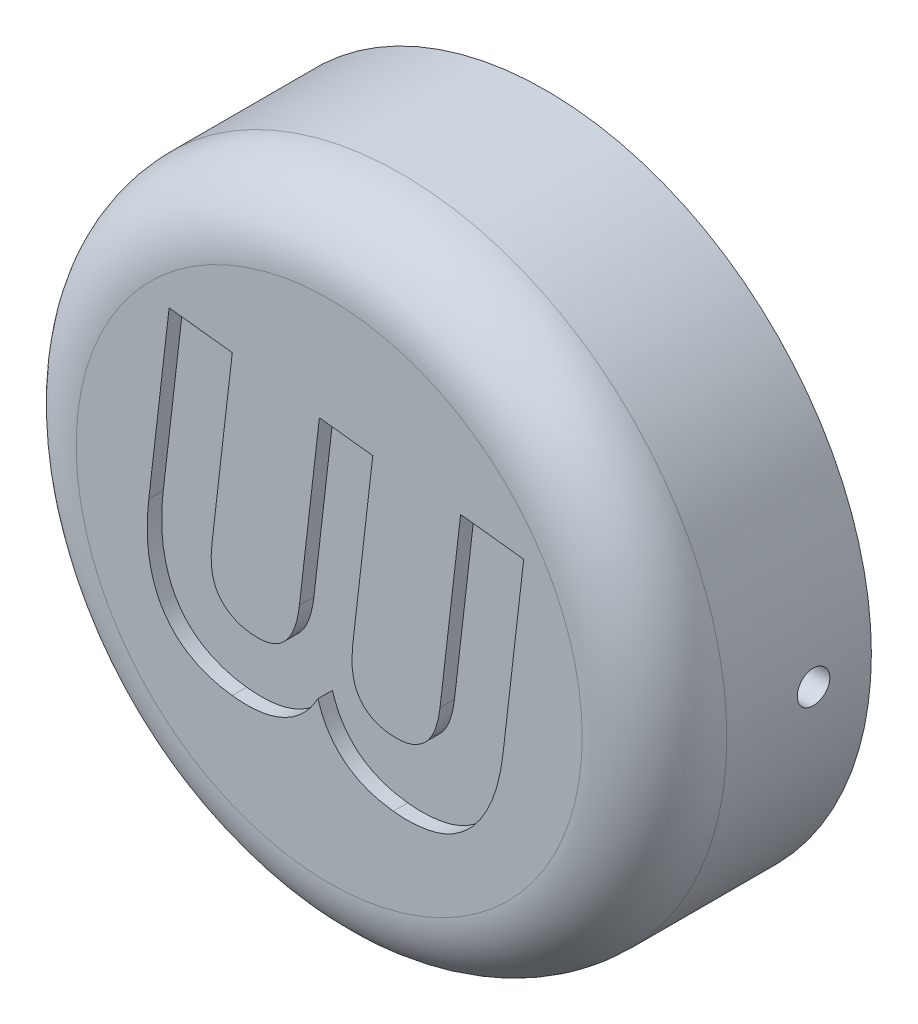
from build123d import *

# Parameters (mm, degrees)
ESQUISSE1_R                  = 45
BOSS_EXTRU_1_DEPTH           = 30
CONG_1_R                     = 10
ESQUISSE3_R                  = 40
ESQUISSE3_R_2                = 7
ESQUISSE3_R_3                = 3.15
ENL_V_MAT_EXTRU_1_DEPTH      = 15
CONG_2_R                     = 10
ENL_V_MAT_EXTRU_2_DEPTH      = 2
BOSS_EXTRU_3_DEPTH           = 22
ENL_V_MAT_EXTRU_3_DEPTH      = 8
ESQUISSE14_W                 = 8
ESQUISSE14_H                 = 7.5
ENL_V_MAT_EXTRU_4_DEPTH      = 8
ESQUISSE15_W                 = 1.5
ESQUISSE15_H                 = 14
ESQUISSE15_W_2               = 2.5
BOSS_EXTRU_4_DEPTH           = 15
ENL_V_MAT_EXTRU_5_DEPTH      = 31
ENL_V_MAT_EXTRU_5_DEPTH_BACK = 15
ESQUISSE16_R                 = 2.25
CONG_3_R                     = 5
ESQUISSE17_R                 = 7
ENL_V_MAT_EXTRU_6_DEPTH      = 8


with BuildPart() as part:
    # Esquisse1 → Boss.-Extru.1 (new body)
    with BuildSketch(Plane.XY):
        Circle(ESQUISSE1_R)
    extrude(amount=BOSS_EXTRU_1_DEPTH)

    # Congé1
    cong_1_edges = [part.edges().sort_by_distance(p)[0] for p in [
        (-45, 0, 30),
    ]]
    fillet(cong_1_edges, radius=CONG_1_R)

    # Esquisse3 → Enlèv. mat.-Extru.1 (cut)
    # profile 1 of 2: a face of its own
    with BuildSketch(Plane(origin=(0, 0, 0), x_dir=(-1, 0, 0), z_dir=(0, 0, -1))):
        Circle(ESQUISSE3_R)
        Circle(ESQUISSE3_R_2, mode=Mode.SUBTRACT)
    # profile 2 of 2: a face of its own
    with BuildSketch(Plane(origin=(0, 0, 0), x_dir=(-1, 0, 0), z_dir=(0, 0, -1))):
        Circle(ESQUISSE3_R_3)
    extrude(amount=-ENL_V_MAT_EXTRU_1_DEPTH, mode=Mode.SUBTRACT)

    # Congé2
    cong_2_edges = [part.edges().sort_by_distance(p)[0] for p in [
        (40, 0, 15),
    ]]
    fillet(cong_2_edges, radius=CONG_2_R)

    # Esquisse4 → Enlèv. mat.-Extru.2 (cut)
    with BuildSketch(Plane.XY.offset(30)):
        with BuildLine():
            Line((-22.144645679, 22.871728166), (-13.411684949, 21.864078851))
            Line((-13.411684949, 21.864078851), (-16.224705953, -2.434964528))
            add(Edge.make_bspline(
                [(-16.224705953, -2.434964528), (-16.256895394, -2.749529996), (-16.318662647, -3.353139284), (-16.340974486, -4.233864403), (-16.297568174, -5.05080651), (-16.209258973, -5.810700887), (-16.049709468, -6.510266382), (-15.835926627, -7.151237119), (-15.544352246, -7.724871201), (-15.102471016, -8.410829584), (-14.391447141, -9.137358845), (-13.364077291, -9.804334199), (-12.168771745, -10.281809796), (-11.302704519, -10.415743134), (-10.850576273, -10.485662702)],
                knots=[0, 0, 0, 0, 1.029052784, 1.9746154, 2.864125884, 3.690516433, 4.461360084, 5.196106019, 5.883704519, 6.550229516, 7.847027763, 9.154782256, 10.514661136, 12, 12, 12, 12], degree=3))
            add(Edge.make_bspline(
                [(-10.850576273, -10.485662702), (-10.388538715, -10.518722359), (-9.507769114, -10.581743082), (-8.241462414, -10.373028261), (-7.130743608, -9.898839405), (-6.180259361, -9.165116879), (-5.41633373, -8.159424838), (-4.807311446, -6.915829185), (-4.36244309, -5.421735756), (-4.205585893, -4.334155707), (-4.122417825, -3.757504254)],
                knots=[0, 0, 0, 0, 1.021408317, 1.94708283, 2.80626198, 3.666415336, 4.56998295, 5.573071206, 6.71320551, 8, 8, 8, 8], degree=3))
            Line((-4.122417825, -3.757504254), (-1.361878556, 20.100692549))
            Line((-1.361878556, 20.100692549), (6.027549754, 19.239992093))
            Line((6.027549754, 19.239992093), (3.246017791, -4.838627999))
            add(Edge.make_bspline(
                [(3.246017791, -4.838627999), (3.195337805, -5.418932779), (3.100060271, -6.509896153), (3.200846418, -8.063631191), (3.502191789, -9.416150043), (4.030577709, -10.569421741), (4.79817358, -11.502650362), (5.789145136, -12.206937692), (6.981097787, -12.714787486), (7.862811963, -12.849833616), (8.326249754, -12.920815213)],
                knots=[0, 0, 0, 0, 1.281245697, 2.408720684, 3.414105471, 4.317064152, 5.176266696, 6.042350125, 6.971039643, 8, 8, 8, 8], degree=3))
            add(Edge.make_bspline(
                [(8.326249754, -12.920815213), (8.788141435, -12.95187261), (9.670978885, -13.011234217), (10.951767235, -12.825942037), (12.09662951, -12.373936159), (12.926595681, -11.793896672), (13.517779888, -11.226565316), (13.904051152, -10.714814626), (14.251276342, -10.139874431), (14.570575393, -9.505698745), (14.812975228, -8.791702106), (15.036199887, -8.026114103), (15.218288171, -7.192139962), (15.290111141, -6.609767539), (15.327313225, -6.308116583)],
                knots=[0, 0, 0, 0, 1.514963289, 2.895627662, 4.203605979, 5.514649424, 6.187972473, 6.883219808, 7.609208956, 8.389033415, 9.205462736, 10.07686117, 11.003873391, 12, 12, 12, 12], degree=3))
            Line((15.327313225, -6.308116583), (18.17182327, 18.274328166))
            Line((18.17182327, 18.274328166), (26.904784001, 17.266678851))
            Line((26.904784001, 17.266678851), (24.060273955, -7.315765898))
            add(Edge.make_bspline(
                [(24.060273955, -7.315765898), (23.967955783, -8.006475678), (23.789795838, -9.339439852), (23.384357503, -11.243708182), (22.85722021, -12.976937412), (22.232797618, -14.545925787), (21.501446812, -15.949427752), (20.701837208, -17.210493748), (19.823941524, -18.330780706), (18.850170073, -19.291918516), (17.80713126, -20.105941628), (16.692463853, -20.773870797), (15.510213899, -21.304477515), (14.25612176, -21.680062816), (12.955241569, -21.910077191), (11.619045856, -22.055429721), (10.247905107, -22.064471081), (9.32643267, -21.979861564), (8.861563453, -21.937177314)],
                knots=[0, 0, 0, 0, 1.394876439, 2.691898066, 3.892940253, 5.018147218, 6.067743577, 7.056852335, 8.004277114, 8.910753966, 9.789328284, 10.647102319, 11.506305359, 12.377222316, 13.26067029, 14.147997917, 15.065692338, 16, 16, 16, 16], degree=3))
            add(Edge.make_bspline(
                [(8.861563453, -21.937177314), (8.193397296, -21.838611708), (6.905963094, -21.64869378), (5.09075363, -21.099474321), (3.476356998, -20.341045448), (2.056804317, -19.378476271), (0.854405876, -18.205860501), (-0.171754699, -16.868311251), (-0.984609243, -15.338236734), (-1.366188524, -14.231821472), (-1.56130915, -13.666055852)],
                knots=[0, 0, 0, 0, 1.141163769, 2.198814248, 3.194086385, 4.147709345, 5.085148259, 6.022512461, 6.988811434, 8, 8, 8, 8], degree=3))
            add(Edge.make_bspline(
                [(-1.56130915, -13.666055852), (-1.871640737, -14.180350205), (-2.475746289, -15.181498932), (-3.614218819, -16.476909983), (-4.899960101, -17.530118409), (-6.330522074, -18.355291156), (-7.908683346, -18.929201697), (-9.627036508, -19.274410878), (-11.485566119, -19.393346682), (-12.761481825, -19.278232362), (-13.422181296, -19.218623432)],
                knots=[0, 0, 0, 0, 1.028409916, 2.001949416, 2.939882333, 3.867066551, 4.819923276, 5.805897814, 6.863841753, 8, 8, 8, 8], degree=3))
            add(Edge.make_bspline(
                [(-13.422181296, -19.218623432), (-13.899737749, -19.154485913), (-14.838533125, -19.028402376), (-16.198819588, -18.681486488), (-17.495358388, -18.246704571), (-18.716659117, -17.688648624), (-19.854452529, -17.019622786), (-20.894753111, -16.223737722), (-21.831175407, -15.306627023), (-22.667865015, -14.26853153), (-23.394554113, -13.106606892), (-24.004820997, -11.821339515), (-24.481775919, -10.4096633), (-24.866331461, -8.881644272), (-25.105076103, -7.214751414), (-25.186086506, -5.41002077), (-25.163088385, -3.462876846), (-25.027862816, -2.122901673), (-24.957666684, -1.427315213)],
                knots=[0, 0, 0, 0, 0.95812083, 1.883503822, 2.788440276, 3.676396848, 4.550459974, 5.409672077, 6.276215641, 7.152632684, 8.056711632, 8.997240929, 9.97707405, 11.017285228, 12.128953384, 13.32118734, 14.609417657, 16, 16, 16, 16], degree=3))
            Line((-24.957666684, -1.427315213), (-22.144645679, 22.871728166))
        make_face()
    extrude(amount=-ENL_V_MAT_EXTRU_2_DEPTH, mode=Mode.SUBTRACT)

    # Esquisse12 → Boss.-Extru.3 (add)
    with BuildSketch(Plane(origin=(0, 0, 0), x_dir=(-1, 0, 0), z_dir=(0, 0, -1))):
        with BuildLine():
            ThreePointArc((0, 7), (-7, 0), (0, -7))
            Line((0, -7), (0, -3.15))
            ThreePointArc((0, -3.15), (-3.15, 0), (0, 3.15))
            Line((0, 3.15), (0, 7))
        make_face()
        with BuildLine():
            Line((0, -3.15), (0, -7))
            ThreePointArc((0, -7), (4.949747468, -4.949747468), (7, 0))
            ThreePointArc((7, 0), (4.949747468, 4.949747468), (0, 7))
            Line((0, 7), (0, 3.15))
            ThreePointArc((0, 3.15), (2.227386361, 2.227386361), (3.15, 0))
            ThreePointArc((3.15, 0), (2.227386361, -2.227386361), (0, -3.15))
        make_face()
        with BuildLine():
            Line((-14, -7), (0, -7))
            ThreePointArc((0, -7), (-7, 0), (0, 7))
            Line((0, 7), (-14, 7))
            Line((-14, 7), (-14, -7))
        make_face()
    extrude(amount=-BOSS_EXTRU_3_DEPTH)

    # Esquisse13 → Enlèv. mat.-Extru.3 (cut)
    with BuildSketch(Plane(origin=(14, 0, 0), x_dir=(0, 0, -1), z_dir=(1, 0, 0))):
        Polygon((-10.165063509, 3.75), (-12.330127019, 0), (-10.165063509, -3.75), (-5.834936491, -3.75), (-3.669872981, 0), (-5.834936491, 3.75), align=None)
    extrude(amount=-ENL_V_MAT_EXTRU_3_DEPTH, mode=Mode.SUBTRACT)

    # Esquisse14 → Enlèv. mat.-Extru.4 (cut)
    with BuildSketch(Plane(origin=(0, 0, 0), x_dir=(-1, 0, 0), z_dir=(0, 0, -1))):
        with Locations((-10, 0)):
            Rectangle(ESQUISSE14_W, ESQUISSE14_H)
    extrude(amount=-ENL_V_MAT_EXTRU_4_DEPTH, mode=Mode.SUBTRACT)

    # Esquisse15 → Boss.-Extru.4 (add)
    with BuildSketch(Plane(origin=(0, 0, 15), x_dir=(-1, 0, 0), z_dir=(0, 0, -1))):
        with Locations((-14.75, 0)):
            Rectangle(ESQUISSE15_W, ESQUISSE15_H)
        with Locations((-12.75, 0)):
            Rectangle(ESQUISSE15_W_2, ESQUISSE15_H)
    extrude(amount=BOSS_EXTRU_4_DEPTH)

    # Esquisse16 → Enlèv. mat.-Extru.5 (cut, two sides: drawn at the far end of the back side and taken through both)
    with BuildSketch(Plane(origin=(15.5, 0, 0), x_dir=(0, 0, -1), z_dir=(1, 0, 0)).offset(-ENL_V_MAT_EXTRU_5_DEPTH_BACK)):
        with Locations(Location((-8, 0, 0), (0, 0, 180))):
            Circle(ESQUISSE16_R)
    extrude(amount=ENL_V_MAT_EXTRU_5_DEPTH + ENL_V_MAT_EXTRU_5_DEPTH_BACK, mode=Mode.SUBTRACT)

    # Congé3
    cong_3_edges = [part.edges().sort_by_distance(p)[0] for p in [
        (15.5, 0, 15),
        (-7, 0, 15),
        (7.75, -7, 15),
        (7.75, 7, 15),
    ]]
    fillet(cong_3_edges, radius=CONG_3_R)

    # Esquisse17 → Enlèv. mat.-Extru.6 (cut)
    with BuildSketch(Plane(origin=(15.5, 0, 0), x_dir=(0, 0, -1), z_dir=(1, 0, 0))):
        with Locations((-8.317654901, 0)):
            Circle(ESQUISSE17_R)
    extrude(amount=ENL_V_MAT_EXTRU_6_DEPTH, mode=Mode.SUBTRACT)


solid = part.part
